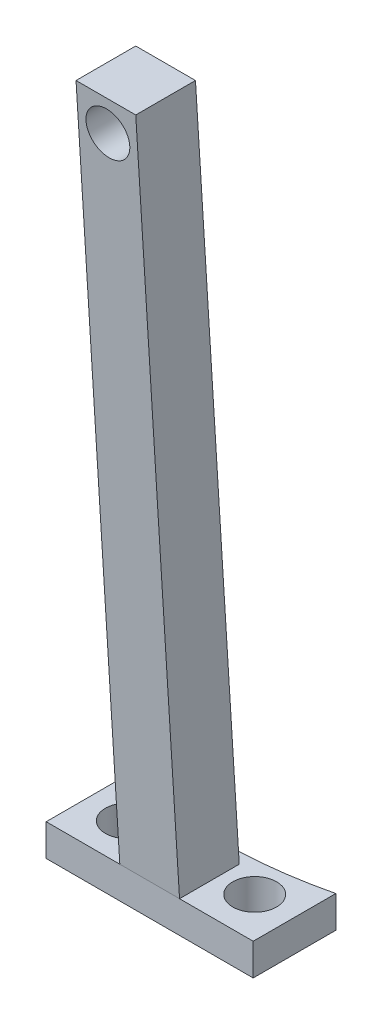
from build123d import *

# Parameters (mm, degrees)
BOSS_EXTRUDE1_DEPTH     = 2
SKETCH2_R               = 1.375
CUT_EXTRUDE1_DEPTH      = 2
CUT_EXTRUDE3_DEPTH      = 47.745974282
CUT_EXTRUDE3_DEPTH_BACK = 47.745974282
SKETCH12_R              = 1.375


with BuildPart() as part:
    # Sketch1 → Boss-Extrude1 (new body)
    with BuildSketch(Plane(origin=(0, 0, 0), x_dir=(1, 0, 0), z_dir=(0, 1, 0))):
        with BuildLine():
            Line((-6.5, 0), (6.5, 0))
            Line((6.5, 0), (6.5, 5.19))
            add(Edge.make_bspline(
                [(-6.5, 5.19), (0, 3.63), (6.5, 5.19)],
                knots=[0, 0, 0, 1, 1, 1], degree=2))
            Line((-6.5, 5.19), (-6.5, 0))
        make_face()
    extrude(amount=BOSS_EXTRUDE1_DEPTH)

    # Sketch2 → Cut-Extrude1 (cut)
    with BuildSketch(Plane(origin=(0, 2, 0), x_dir=(1, 0, 0), z_dir=(0, 1, 0))):
        with Locations(Location((-4, 2.595, 0), (0, 0, 270))):
            Circle(SKETCH2_R)
        with Locations(Location((4, 2.595, 0), (0, 0, 270))):
            Circle(SKETCH2_R)
    extrude(amount=-CUT_EXTRUDE1_DEPTH, mode=Mode.SUBTRACT)

    # Sketch4 → Loft2 section 0
    with BuildSketch(Plane(origin=(0, 2, 0), x_dir=(1, 0, 0), z_dir=(0, 1, 0))):
        with BuildLine():
            Line((-1.875, 3.75), (1.875, 3.75))
            Line((1.875, 3.75), (1.875, 0))
            Line((1.875, 0), (-1.875, 0))
            Line((-1.875, 0), (-1.875, 3.75))
        make_face()
    # Sketch6 → Loft2 section 1
    with BuildSketch(Plane(origin=(0, 46, 0), x_dir=(1, 0, 0), z_dir=(0, 1, 0))):
        with BuildLine():
            Line((-1.875, 1), (1.875, 1))
            Line((1.875, 1), (1.875, -2.75))
            Line((1.875, -2.75), (-1.875, -2.75))
            Line((-1.875, -2.75), (-1.875, 1))
        make_face()
    loft()

    # Sketch12 → Cut-Extrude3 (cut, two sides: drawn at the far end of the back side and taken through both)
    with BuildSketch(Plane.XY.offset(-CUT_EXTRUDE3_DEPTH_BACK)):
        with Locations(Location((0, 44, 0), (0, 0, 90))):
            Circle(SKETCH12_R)
    extrude(amount=CUT_EXTRUDE3_DEPTH + CUT_EXTRUDE3_DEPTH_BACK, mode=Mode.SUBTRACT)


solid = part.part
